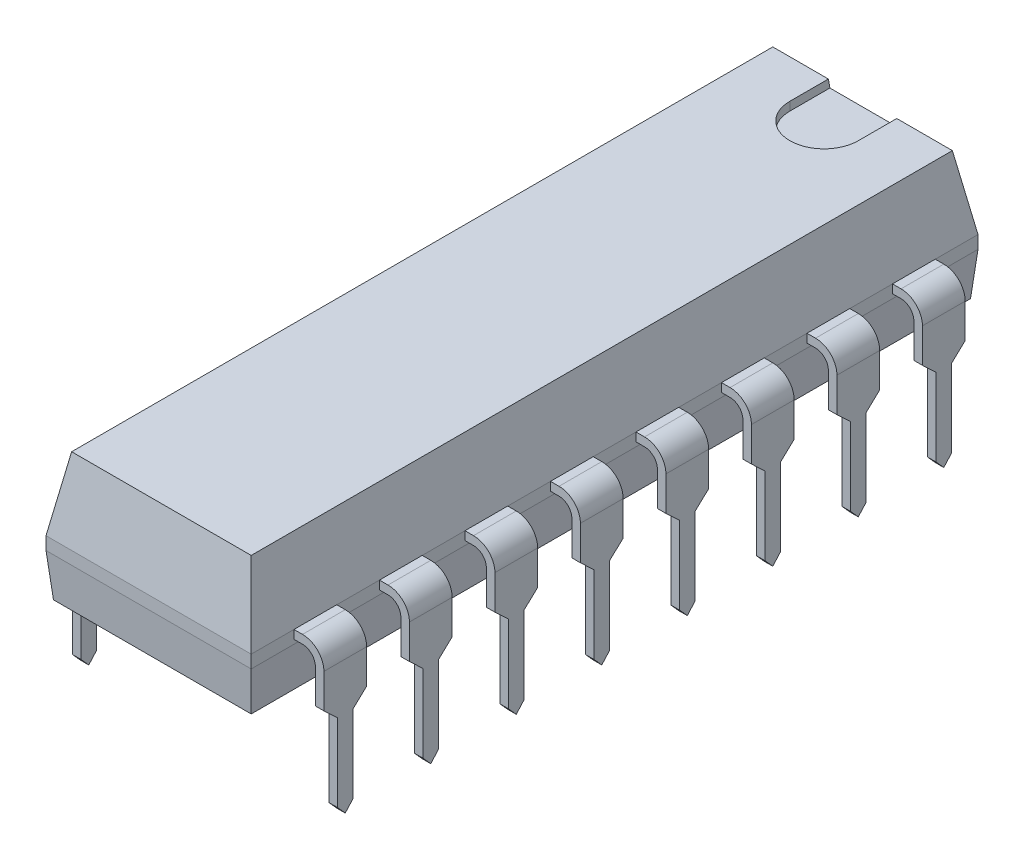
from build123d import *
from OCP.BRepFilletAPI import BRepFilletAPI_MakeChamfer

# Parameters (mm, degrees)
SKETCH1_W                = 21.59
SKETCH1_H                = 6.096
BASE_EXTRUDE_DEPTH       = 3.81
CHAMFER1_SIZE            = 2.159
CHAMFER1_SIZE2           = 0.380689951
CHAMFER2_SIZE            = 1.27
CHAMFER2_SIZE2           = 0.111110603
CUT_EXTRUDE1_DEPTH       = 0.254
BOSS_EXTRUDE_THIN1_DEPTH = 0.635
CUT_EXTRUDE2_DEPTH       = 0.254
CUT_EXTRUDE3_DEPTH       = 0.254
LPATTERN1_COUNT          = 8
LPATTERN1_PITCH          = 2.54
MIRROR1_COPY_1_DEPTH     = 0.635
MIRROR1_COPY_2_DEPTH     = 0.635
MIRROR1_COPY_3_DEPTH     = 0.635
MIRROR1_COPY_4_DEPTH     = 0.635
MIRROR1_COPY_5_DEPTH     = 0.635
MIRROR1_COPY_6_DEPTH     = 0.635
MIRROR1_COPY_7_DEPTH     = 0.635
MIRROR1_COPY_8_DEPTH     = 0.254
MIRROR1_COPY_9_DEPTH     = 0.254
MIRROR1_COPY_10_DEPTH    = 0.254
MIRROR1_COPY_11_DEPTH    = 0.254
MIRROR1_COPY_12_DEPTH    = 0.254
MIRROR1_COPY_13_DEPTH    = 0.254
MIRROR1_COPY_14_DEPTH    = 0.254
MIRROR1_COPY_15_DEPTH    = 0.254
MIRROR1_COPY_16_DEPTH    = 0.254
MIRROR1_COPY_17_DEPTH    = 0.254
MIRROR1_COPY_18_DEPTH    = 0.254
MIRROR1_COPY_19_DEPTH    = 0.254
MIRROR1_COPY_20_DEPTH    = 0.254
MIRROR1_COPY_21_DEPTH    = 0.254


with BuildPart() as part:
    # Sketch1 → Base-Extrude (new body)
    with BuildSketch(Plane(origin=(0, 0.381, 0), x_dir=(0, 0, -1), z_dir=(0, 1, 0))):
        with Locations((-8.89, -3.81)):
            Rectangle(SKETCH1_W, SKETCH1_H)
    extrude(amount=BASE_EXTRUDE_DEPTH)

    # Chamfer1: one chamfer whose edges measure the first distance from different faces: ONE call of the kernel's chamfer builder (chamfer() names one face for all edges)
    chamfer1_edges_1 = [part.edges().sort_by_distance(p)[0] for p in [
        (3.81, 4.191, 19.685),
    ]]
    chamfer1_side_1 = [part.faces().sort_by_distance(p)[0] for p in [
        (3.81, 2.286, 19.685),
    ]]
    chamfer1_edges_2 = [part.edges().sort_by_distance(p)[0] for p in [
        (6.858, 4.191, 8.89),
    ]]
    chamfer1_side_2 = [part.faces().sort_by_distance(p)[0] for p in [
        (6.858, 2.286, 8.89),
    ]]
    chamfer1_edges_3 = [part.edges().sort_by_distance(p)[0] for p in [
        (3.81, 4.191, -1.905),
    ]]
    chamfer1_side_3 = [part.faces().sort_by_distance(p)[0] for p in [
        (3.81, 2.286, -1.905),
    ]]
    chamfer1_edges_4 = [part.edges().sort_by_distance(p)[0] for p in [
        (0.762, 4.191, 8.89),
    ]]
    chamfer1_side_4 = [part.faces().sort_by_distance(p)[0] for p in [
        (0.762, 2.286, 8.89),
    ]]
    chamfer1 = BRepFilletAPI_MakeChamfer(part.part.solid().wrapped)
    for e in chamfer1_edges_1:
        chamfer1.Add(CHAMFER1_SIZE, CHAMFER1_SIZE2, e.wrapped, chamfer1_side_1[0].wrapped)  # the first distance lies on this face
    for e in chamfer1_edges_2:
        chamfer1.Add(CHAMFER1_SIZE, CHAMFER1_SIZE2, e.wrapped, chamfer1_side_2[0].wrapped)  # the first distance lies on this face
    for e in chamfer1_edges_3:
        chamfer1.Add(CHAMFER1_SIZE, CHAMFER1_SIZE2, e.wrapped, chamfer1_side_3[0].wrapped)  # the first distance lies on this face
    for e in chamfer1_edges_4:
        chamfer1.Add(CHAMFER1_SIZE, CHAMFER1_SIZE2, e.wrapped, chamfer1_side_4[0].wrapped)  # the first distance lies on this face
    add(Compound.cast(chamfer1.Shape()), mode=Mode.REPLACE)

    # Chamfer2: one chamfer whose edges measure the first distance from different faces: ONE call of the kernel's chamfer builder (chamfer() names one face for all edges)
    chamfer2_edges_1 = [part.edges().sort_by_distance(p)[0] for p in [
        (6.858, 0.381, 8.89),
    ]]
    chamfer2_side_1 = [part.faces().sort_by_distance(p)[0] for p in [
        (6.858, 1.2065, 8.89),
    ]]
    chamfer2_edges_2 = [part.edges().sort_by_distance(p)[0] for p in [
        (3.81, 0.381, 19.685),
    ]]
    chamfer2_side_2 = [part.faces().sort_by_distance(p)[0] for p in [
        (3.81, 1.2065, 19.685),
    ]]
    chamfer2_edges_3 = [part.edges().sort_by_distance(p)[0] for p in [
        (0.762, 0.381, 8.89),
    ]]
    chamfer2_side_3 = [part.faces().sort_by_distance(p)[0] for p in [
        (0.762, 1.2065, 8.89),
    ]]
    chamfer2_edges_4 = [part.edges().sort_by_distance(p)[0] for p in [
        (3.81, 0.381, -1.905),
    ]]
    chamfer2_side_4 = [part.faces().sort_by_distance(p)[0] for p in [
        (3.81, 1.2065, -1.905),
    ]]
    chamfer2 = BRepFilletAPI_MakeChamfer(part.part.solid().wrapped)
    for e in chamfer2_edges_1:
        chamfer2.Add(CHAMFER2_SIZE, CHAMFER2_SIZE2, e.wrapped, chamfer2_side_1[0].wrapped)  # the first distance lies on this face
    for e in chamfer2_edges_2:
        chamfer2.Add(CHAMFER2_SIZE, CHAMFER2_SIZE2, e.wrapped, chamfer2_side_2[0].wrapped)  # the first distance lies on this face
    for e in chamfer2_edges_3:
        chamfer2.Add(CHAMFER2_SIZE, CHAMFER2_SIZE2, e.wrapped, chamfer2_side_3[0].wrapped)  # the first distance lies on this face
    for e in chamfer2_edges_4:
        chamfer2.Add(CHAMFER2_SIZE, CHAMFER2_SIZE2, e.wrapped, chamfer2_side_4[0].wrapped)  # the first distance lies on this face
    add(Compound.cast(chamfer2.Shape()), mode=Mode.REPLACE)

    # Sketch2 → Cut-Extrude1 (cut)
    with BuildSketch(Plane(origin=(0, 4.191, 0), x_dir=(-1, 0, 0), z_dir=(0, 1, 0))):
        with BuildLine():
            Line((-2.794, -1.905), (-4.826, -1.905))
            Line((-4.826, -1.905), (-4.826, -0.381))
            ThreePointArc((-4.826, -0.381), (-3.81, 0.635), (-2.794, -0.381))
            Line((-2.794, -0.381), (-2.794, -1.905))
        make_face()
    extrude(amount=-CUT_EXTRUDE1_DEPTH, mode=Mode.SUBTRACT)

    # Sketch3 → Boss-Extrude-Thin1 (add, symmetric)
    with BuildSketch(Plane(origin=(9.017, 0, 0), x_dir=(-1, 0, 0), z_dir=(0, 0, -1))):
        with BuildLine():
            Line((6.094612647, 1.778), (8.509, 1.778))
            ThreePointArc((8.509, 1.778), (8.778407684, 1.666407684), (8.89, 1.397))
            Line((8.89, 1.397), (8.89, -2.5654))
            Line((8.89, -2.5654), (9.144, -2.5654))
            Line((9.144, -2.5654), (9.144, 1.397))
            ThreePointArc((9.144, 1.397), (8.958012806, 1.846012806), (8.509, 2.032))
            Line((8.509, 2.032), (6.094612647, 2.032))
            Line((6.094612647, 2.032), (6.094612647, 1.778))
        make_face()
    boss_extrude_thin1 = extrude(amount=BOSS_EXTRUDE_THIN1_DEPTH, both=True)

    # Sketch4 → Cut-Extrude2 (cut)
    with BuildSketch(Plane(origin=(0.127, 0, 0), x_dir=(0, 0, -1), z_dir=(1, 0, 0))):
        Polygon((-0.635, 0.381), (-0.2286, 0), (-0.2286, -2.309519874), (0, -2.5654), (-0.635, -2.5654), align=None)
    cut_extrude2 = extrude(amount=-CUT_EXTRUDE2_DEPTH, mode=Mode.SUBTRACT)

    # Sketch5 → Cut-Extrude3 (cut)
    with BuildSketch(Plane(origin=(0.127, 0, 0), x_dir=(0, 0, -1), z_dir=(1, 0, 0))):
        Polygon((0.635, -2.5654), (0, -2.5654), (0.2286, -2.309519874), (0.2286, 0), (0.635, 0.381), align=None)
    cut_extrude3 = extrude(amount=-CUT_EXTRUDE3_DEPTH, mode=Mode.SUBTRACT)

    # LPattern1: Boss-Extrude-Thin1, Cut-Extrude2, Cut-Extrude3 ×8
    with Locations(*[(0, 0, i * LPATTERN1_PITCH) for i in range(1, LPATTERN1_COUNT)]):
        add(boss_extrude_thin1)
        add(cut_extrude2, mode=Mode.SUBTRACT)
        add(cut_extrude3, mode=Mode.SUBTRACT)

    # Mirror1: Boss-Extrude-Thin1, Cut-Extrude2, Cut-Extrude3 across plane
    add(boss_extrude_thin1.mirror(Plane(origin=(3.81, 0, 0), x_dir=(0, 0, 1), z_dir=(1, 0, 0))))
    add(cut_extrude2.mirror(Plane(origin=(3.81, 0, 0), x_dir=(0, 0, 1), z_dir=(1, 0, 0))), mode=Mode.SUBTRACT)
    add(cut_extrude3.mirror(Plane(origin=(3.81, 0, 0), x_dir=(0, 0, 1), z_dir=(1, 0, 0))), mode=Mode.SUBTRACT)

    # Mirror1 copy 1 sketch → Mirror1 copy 1 (add, symmetric)
    with BuildSketch(Plane(origin=(-1.397, 0, 2.54), x_dir=(1, 0, 0), z_dir=(0, 0, -1))):
        with BuildLine():
            Line((6.094612647, -1.778), (8.509, -1.778))
            ThreePointArc((8.509, -1.778), (8.778407684, -1.666407684), (8.89, -1.397))
            Line((8.89, -1.397), (8.89, 2.5654))
            Line((8.89, 2.5654), (9.144, 2.5654))
            Line((9.144, 2.5654), (9.144, -1.397))
            ThreePointArc((9.144, -1.397), (8.958012806, -1.846012806), (8.509, -2.032))
            Line((8.509, -2.032), (6.094612647, -2.032))
            Line((6.094612647, -2.032), (6.094612647, -1.778))
        make_face()
    extrude(amount=MIRROR1_COPY_1_DEPTH, both=True)

    # Mirror1 copy 2 sketch → Mirror1 copy 2 (add, symmetric)
    with BuildSketch(Plane(origin=(-1.397, 0, 5.08), x_dir=(1, 0, 0), z_dir=(0, 0, -1))):
        with BuildLine():
            Line((6.094612647, -1.778), (8.509, -1.778))
            ThreePointArc((8.509, -1.778), (8.778407684, -1.666407684), (8.89, -1.397))
            Line((8.89, -1.397), (8.89, 2.5654))
            Line((8.89, 2.5654), (9.144, 2.5654))
            Line((9.144, 2.5654), (9.144, -1.397))
            ThreePointArc((9.144, -1.397), (8.958012806, -1.846012806), (8.509, -2.032))
            Line((8.509, -2.032), (6.094612647, -2.032))
            Line((6.094612647, -2.032), (6.094612647, -1.778))
        make_face()
    extrude(amount=MIRROR1_COPY_2_DEPTH, both=True)

    # Mirror1 copy 3 sketch → Mirror1 copy 3 (add, symmetric)
    with BuildSketch(Plane(origin=(-1.397, 0, 7.62), x_dir=(1, 0, 0), z_dir=(0, 0, -1))):
        with BuildLine():
            Line((6.094612647, -1.778), (8.509, -1.778))
            ThreePointArc((8.509, -1.778), (8.778407684, -1.666407684), (8.89, -1.397))
            Line((8.89, -1.397), (8.89, 2.5654))
            Line((8.89, 2.5654), (9.144, 2.5654))
            Line((9.144, 2.5654), (9.144, -1.397))
            ThreePointArc((9.144, -1.397), (8.958012806, -1.846012806), (8.509, -2.032))
            Line((8.509, -2.032), (6.094612647, -2.032))
            Line((6.094612647, -2.032), (6.094612647, -1.778))
        make_face()
    extrude(amount=MIRROR1_COPY_3_DEPTH, both=True)

    # Mirror1 copy 4 sketch → Mirror1 copy 4 (add, symmetric)
    with BuildSketch(Plane(origin=(-1.397, 0, 10.16), x_dir=(1, 0, 0), z_dir=(0, 0, -1))):
        with BuildLine():
            Line((6.094612647, -1.778), (8.509, -1.778))
            ThreePointArc((8.509, -1.778), (8.778407684, -1.666407684), (8.89, -1.397))
            Line((8.89, -1.397), (8.89, 2.5654))
            Line((8.89, 2.5654), (9.144, 2.5654))
            Line((9.144, 2.5654), (9.144, -1.397))
            ThreePointArc((9.144, -1.397), (8.958012806, -1.846012806), (8.509, -2.032))
            Line((8.509, -2.032), (6.094612647, -2.032))
            Line((6.094612647, -2.032), (6.094612647, -1.778))
        make_face()
    extrude(amount=MIRROR1_COPY_4_DEPTH, both=True)

    # Mirror1 copy 5 sketch → Mirror1 copy 5 (add, symmetric)
    with BuildSketch(Plane(origin=(-1.397, 0, 12.7), x_dir=(1, 0, 0), z_dir=(0, 0, -1))):
        with BuildLine():
            Line((6.094612647, -1.778), (8.509, -1.778))
            ThreePointArc((8.509, -1.778), (8.778407684, -1.666407684), (8.89, -1.397))
            Line((8.89, -1.397), (8.89, 2.5654))
            Line((8.89, 2.5654), (9.144, 2.5654))
            Line((9.144, 2.5654), (9.144, -1.397))
            ThreePointArc((9.144, -1.397), (8.958012806, -1.846012806), (8.509, -2.032))
            Line((8.509, -2.032), (6.094612647, -2.032))
            Line((6.094612647, -2.032), (6.094612647, -1.778))
        make_face()
    extrude(amount=MIRROR1_COPY_5_DEPTH, both=True)

    # Mirror1 copy 6 sketch → Mirror1 copy 6 (add, symmetric)
    with BuildSketch(Plane(origin=(-1.397, 0, 15.24), x_dir=(1, 0, 0), z_dir=(0, 0, -1))):
        with BuildLine():
            Line((6.094612647, -1.778), (8.509, -1.778))
            ThreePointArc((8.509, -1.778), (8.778407684, -1.666407684), (8.89, -1.397))
            Line((8.89, -1.397), (8.89, 2.5654))
            Line((8.89, 2.5654), (9.144, 2.5654))
            Line((9.144, 2.5654), (9.144, -1.397))
            ThreePointArc((9.144, -1.397), (8.958012806, -1.846012806), (8.509, -2.032))
            Line((8.509, -2.032), (6.094612647, -2.032))
            Line((6.094612647, -2.032), (6.094612647, -1.778))
        make_face()
    extrude(amount=MIRROR1_COPY_6_DEPTH, both=True)

    # Mirror1 copy 7 sketch → Mirror1 copy 7 (add, symmetric)
    with BuildSketch(Plane(origin=(-1.397, 0, 17.78), x_dir=(1, 0, 0), z_dir=(0, 0, -1))):
        with BuildLine():
            Line((6.094612647, -1.778), (8.509, -1.778))
            ThreePointArc((8.509, -1.778), (8.778407684, -1.666407684), (8.89, -1.397))
            Line((8.89, -1.397), (8.89, 2.5654))
            Line((8.89, 2.5654), (9.144, 2.5654))
            Line((9.144, 2.5654), (9.144, -1.397))
            ThreePointArc((9.144, -1.397), (8.958012806, -1.846012806), (8.509, -2.032))
            Line((8.509, -2.032), (6.094612647, -2.032))
            Line((6.094612647, -2.032), (6.094612647, -1.778))
        make_face()
    extrude(amount=MIRROR1_COPY_7_DEPTH, both=True)

    # Mirror1 copy 8 sketch → Mirror1 copy 8 (cut)
    with BuildSketch(Plane(origin=(7.493, 0, 2.54), x_dir=(0, 0, -1), z_dir=(-1, 0, 0))):
        Polygon((-0.635, -0.381), (-0.2286, 0), (-0.2286, 2.309519874), (0, 2.5654), (-0.635, 2.5654), align=None)
    extrude(amount=-MIRROR1_COPY_8_DEPTH, mode=Mode.SUBTRACT)

    # Mirror1 copy 9 sketch → Mirror1 copy 9 (cut)
    with BuildSketch(Plane(origin=(7.493, 0, 5.08), x_dir=(0, 0, -1), z_dir=(-1, 0, 0))):
        Polygon((-0.635, -0.381), (-0.2286, 0), (-0.2286, 2.309519874), (0, 2.5654), (-0.635, 2.5654), align=None)
    extrude(amount=-MIRROR1_COPY_9_DEPTH, mode=Mode.SUBTRACT)

    # Mirror1 copy 10 sketch → Mirror1 copy 10 (cut)
    with BuildSketch(Plane(origin=(7.493, 0, 7.62), x_dir=(0, 0, -1), z_dir=(-1, 0, 0))):
        Polygon((-0.635, -0.381), (-0.2286, 0), (-0.2286, 2.309519874), (0, 2.5654), (-0.635, 2.5654), align=None)
    extrude(amount=-MIRROR1_COPY_10_DEPTH, mode=Mode.SUBTRACT)

    # Mirror1 copy 11 sketch → Mirror1 copy 11 (cut)
    with BuildSketch(Plane(origin=(7.493, 0, 10.16), x_dir=(0, 0, -1), z_dir=(-1, 0, 0))):
        Polygon((-0.635, -0.381), (-0.2286, 0), (-0.2286, 2.309519874), (0, 2.5654), (-0.635, 2.5654), align=None)
    extrude(amount=-MIRROR1_COPY_11_DEPTH, mode=Mode.SUBTRACT)

    # Mirror1 copy 12 sketch → Mirror1 copy 12 (cut)
    with BuildSketch(Plane(origin=(7.493, 0, 12.7), x_dir=(0, 0, -1), z_dir=(-1, 0, 0))):
        Polygon((-0.635, -0.381), (-0.2286, 0), (-0.2286, 2.309519874), (0, 2.5654), (-0.635, 2.5654), align=None)
    extrude(amount=-MIRROR1_COPY_12_DEPTH, mode=Mode.SUBTRACT)

    # Mirror1 copy 13 sketch → Mirror1 copy 13 (cut)
    with BuildSketch(Plane(origin=(7.493, 0, 15.24), x_dir=(0, 0, -1), z_dir=(-1, 0, 0))):
        Polygon((-0.635, -0.381), (-0.2286, 0), (-0.2286, 2.309519874), (0, 2.5654), (-0.635, 2.5654), align=None)
    extrude(amount=-MIRROR1_COPY_13_DEPTH, mode=Mode.SUBTRACT)

    # Mirror1 copy 14 sketch → Mirror1 copy 14 (cut)
    with BuildSketch(Plane(origin=(7.493, 0, 17.78), x_dir=(0, 0, -1), z_dir=(-1, 0, 0))):
        Polygon((-0.635, -0.381), (-0.2286, 0), (-0.2286, 2.309519874), (0, 2.5654), (-0.635, 2.5654), align=None)
    extrude(amount=-MIRROR1_COPY_14_DEPTH, mode=Mode.SUBTRACT)

    # Mirror1 copy 15 sketch → Mirror1 copy 15 (cut)
    with BuildSketch(Plane(origin=(7.493, 0, 2.54), x_dir=(0, 0, -1), z_dir=(-1, 0, 0))):
        Polygon((0.635, 2.5654), (0, 2.5654), (0.2286, 2.309519874), (0.2286, 0), (0.635, -0.381), align=None)
    extrude(amount=-MIRROR1_COPY_15_DEPTH, mode=Mode.SUBTRACT)

    # Mirror1 copy 16 sketch → Mirror1 copy 16 (cut)
    with BuildSketch(Plane(origin=(7.493, 0, 5.08), x_dir=(0, 0, -1), z_dir=(-1, 0, 0))):
        Polygon((0.635, 2.5654), (0, 2.5654), (0.2286, 2.309519874), (0.2286, 0), (0.635, -0.381), align=None)
    extrude(amount=-MIRROR1_COPY_16_DEPTH, mode=Mode.SUBTRACT)

    # Mirror1 copy 17 sketch → Mirror1 copy 17 (cut)
    with BuildSketch(Plane(origin=(7.493, 0, 7.62), x_dir=(0, 0, -1), z_dir=(-1, 0, 0))):
        Polygon((0.635, 2.5654), (0, 2.5654), (0.2286, 2.309519874), (0.2286, 0), (0.635, -0.381), align=None)
    extrude(amount=-MIRROR1_COPY_17_DEPTH, mode=Mode.SUBTRACT)

    # Mirror1 copy 18 sketch → Mirror1 copy 18 (cut)
    with BuildSketch(Plane(origin=(7.493, 0, 10.16), x_dir=(0, 0, -1), z_dir=(-1, 0, 0))):
        Polygon((0.635, 2.5654), (0, 2.5654), (0.2286, 2.309519874), (0.2286, 0), (0.635, -0.381), align=None)
    extrude(amount=-MIRROR1_COPY_18_DEPTH, mode=Mode.SUBTRACT)

    # Mirror1 copy 19 sketch → Mirror1 copy 19 (cut)
    with BuildSketch(Plane(origin=(7.493, 0, 12.7), x_dir=(0, 0, -1), z_dir=(-1, 0, 0))):
        Polygon((0.635, 2.5654), (0, 2.5654), (0.2286, 2.309519874), (0.2286, 0), (0.635, -0.381), align=None)
    extrude(amount=-MIRROR1_COPY_19_DEPTH, mode=Mode.SUBTRACT)

    # Mirror1 copy 20 sketch → Mirror1 copy 20 (cut)
    with BuildSketch(Plane(origin=(7.493, 0, 15.24), x_dir=(0, 0, -1), z_dir=(-1, 0, 0))):
        Polygon((0.635, 2.5654), (0, 2.5654), (0.2286, 2.309519874), (0.2286, 0), (0.635, -0.381), align=None)
    extrude(amount=-MIRROR1_COPY_20_DEPTH, mode=Mode.SUBTRACT)

    # Mirror1 copy 21 sketch → Mirror1 copy 21 (cut)
    with BuildSketch(Plane(origin=(7.493, 0, 17.78), x_dir=(0, 0, -1), z_dir=(-1, 0, 0))):
        Polygon((0.635, 2.5654), (0, 2.5654), (0.2286, 2.309519874), (0.2286, 0), (0.635, -0.381), align=None)
    extrude(amount=-MIRROR1_COPY_21_DEPTH, mode=Mode.SUBTRACT)


solid = part.part
